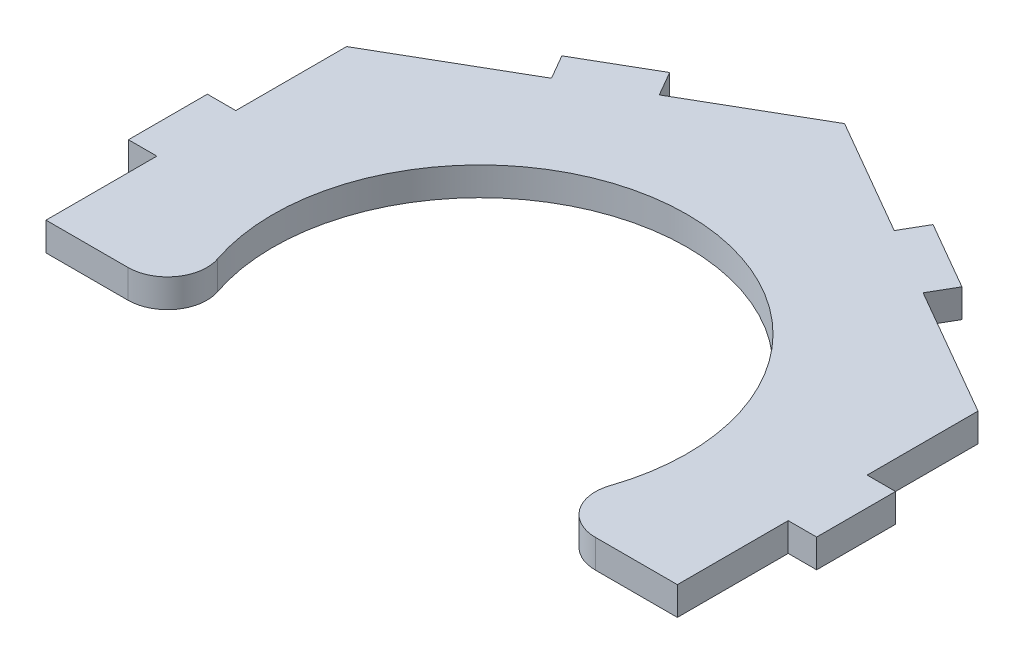
from build123d import *

# Parameters (mm, degrees)
BOSS_EXTRUDE1_DEPTH = 4.572
SKETCH2_W           = 4.572
SKETCH2_H           = 12.7
BOSS_EXTRUDE2_DEPTH = 4.572


with BuildPart() as part:
    # Sketch1 → Boss-Extrude1 (new body)
    with BuildSketch(Plane(origin=(0, 0, 0), x_dir=(1, 0, 0), z_dir=(0, 1, 0))):
        with BuildLine():
            Line((-50.8, -19.05), (-37.600633721, -19.05))
            ThreePointArc((-37.600633721, -19.05), (-32.441869334, -16.402654453), (-31.584532326, -10.668))
            ThreePointArc((-31.584532326, -10.668), (0, 33.3375), (31.584532326, -10.668))
            ThreePointArc((31.584532326, -10.668), (32.441869334, -16.402654453), (37.600633721, -19.05))
            Line((37.600633721, -19.05), (50.8, -19.05))
            Line((50.8, -19.05), (50.8, 29.329393675))
            Line((50.8, 29.329393675), (0, 58.65878735))
            Line((0, 58.65878735), (-50.8, 29.329393675))
            Line((-50.8, 29.329393675), (-50.8, -19.05))
        make_face()
    extrude(amount=BOSS_EXTRUDE1_DEPTH)

    # Sketch2 → Boss-Extrude2 (add)
    with BuildSketch(Plane(origin=(0, 4.572, 0), x_dir=(1, 0, 0), z_dir=(0, 1, 0))):
        with Locations((-53.086, 5.139696837)):
            Rectangle(SKETCH2_W, SKETCH2_H)
        Polygon((-29.902807007, 41.394393675), (-32.188807007, 45.353861821), (-21.190284379, 51.703861821), (-18.904284379, 47.744393675), align=None)
        Polygon((18.904284379, 47.744393675), (21.190284379, 51.703861821), (32.188807007, 45.353861821), (29.902807007, 41.394393675), align=None)
        with Locations((53.086, 5.139696837)):
            Rectangle(SKETCH2_W, SKETCH2_H)
    extrude(amount=-BOSS_EXTRUDE2_DEPTH)


solid = part.part
